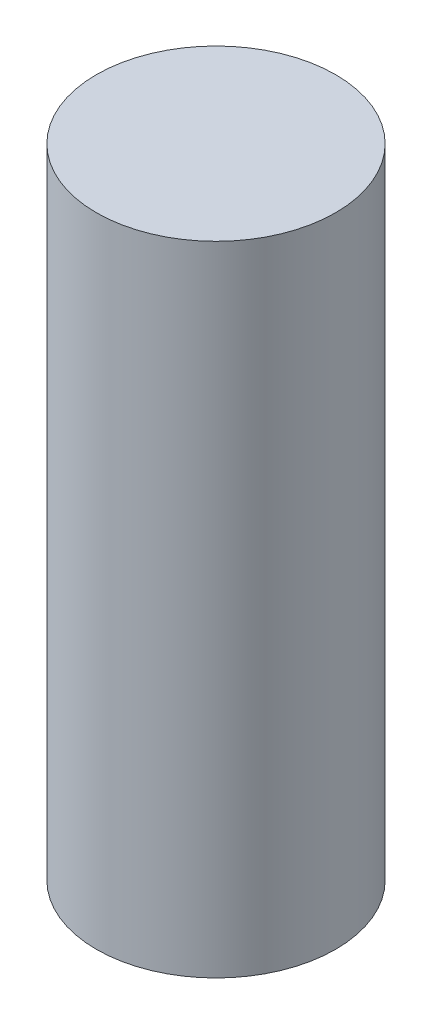
from build123d import *

# Parameters (mm, degrees)
SKETCH1_R           = 3
BOSS_EXTRUDE1_DEPTH = 16


with BuildPart() as part:
    # Sketch1 → Boss-Extrude1 (new body)
    with BuildSketch(Plane(origin=(0, 0, 0), x_dir=(1, 0, 0), z_dir=(0, 1, 0))):
        with Locations(Location((0, 0, 0), (0, 0, 270))):
            Circle(SKETCH1_R)
    extrude(amount=BOSS_EXTRUDE1_DEPTH)


solid = part.part
